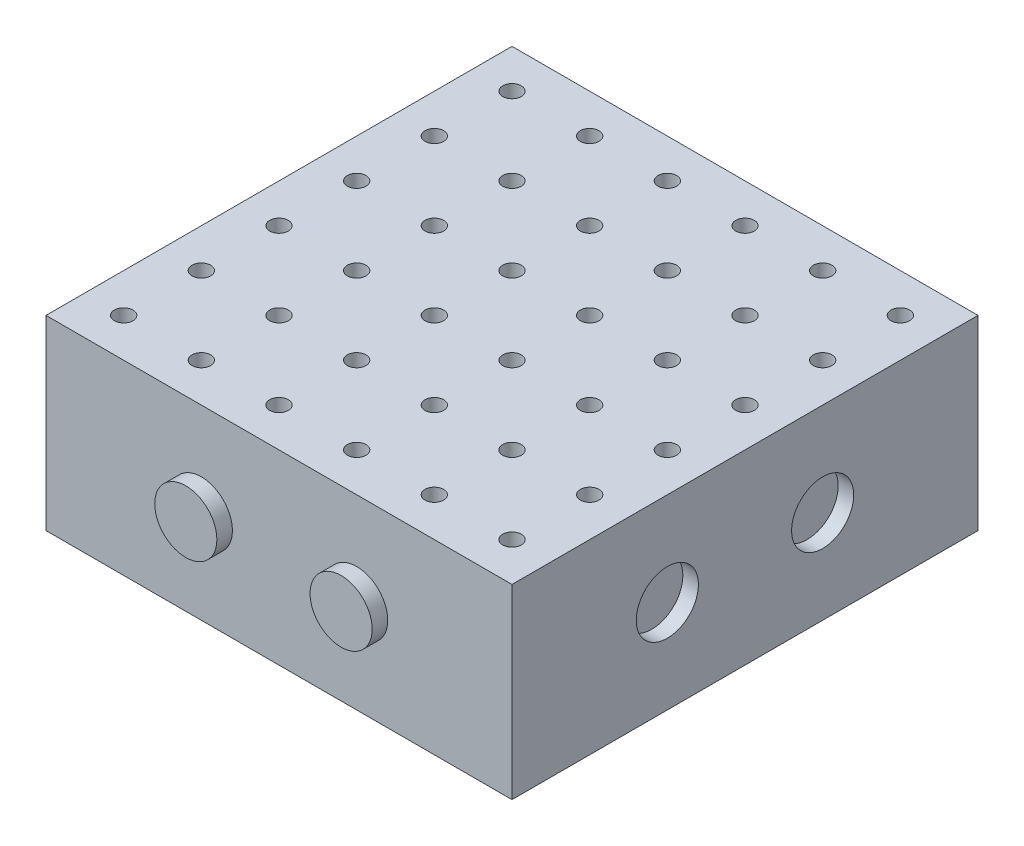
from build123d import *

# Parameters (mm, degrees)
SKETCH1_W           = 150
SKETCH1_H           = 150
SKETCH1_R           = 3
BOSS_EXTRUDE1_DEPTH = 60
SKETCH4_R           = 10
BOSS_EXTRUDE3_DEPTH = 8
SKETCH4_6_R         = 10
CUT_EXTRUDE1_DEPTH  = 5
SKETCH5_R           = 10
CUT_EXTRUDE2_DEPTH  = 5
SKETCH6_R           = 10
BOSS_EXTRUDE4_DEPTH = 5
SKETCH7_R           = 10
BOSS_EXTRUDE5_DEPTH = 5
CUT_EXTRUDE3_DEPTH  = 15


with BuildPart() as part:
    # Sketch1 → Boss-Extrude1 (new body)
    with BuildSketch(Plane(origin=(0, 0, 0), x_dir=(1, 0, 0), z_dir=(0, 1, 0))):
        with Locations((19.022617124, 32.835218094)):
            Rectangle(SKETCH1_W, SKETCH1_H)
        with Locations((-43.477382875, 95.335218094)):
            Circle(SKETCH1_R, mode=Mode.SUBTRACT)
        with Locations((-18.477382875, 95.335218094)):
            Circle(SKETCH1_R, mode=Mode.SUBTRACT)
        with Locations((6.522617125, 95.335218094)):
            Circle(SKETCH1_R, mode=Mode.SUBTRACT)
        with Locations((31.522617125, 95.335218094)):
            Circle(SKETCH1_R, mode=Mode.SUBTRACT)
        with Locations((56.522617125, 95.335218094)):
            Circle(SKETCH1_R, mode=Mode.SUBTRACT)
        with Locations((81.522617125, 95.335218094)):
            Circle(SKETCH1_R, mode=Mode.SUBTRACT)
        with Locations((-18.477382875, 70.335218094)):
            Circle(SKETCH1_R, mode=Mode.SUBTRACT)
        with Locations((6.522617125, 70.335218094)):
            Circle(SKETCH1_R, mode=Mode.SUBTRACT)
        with Locations((31.522617125, 70.335218094)):
            Circle(SKETCH1_R, mode=Mode.SUBTRACT)
        with Locations((56.522617125, 70.335218094)):
            Circle(SKETCH1_R, mode=Mode.SUBTRACT)
        with Locations((81.522617125, 70.335218094)):
            Circle(SKETCH1_R, mode=Mode.SUBTRACT)
        with Locations((-18.477382875, 45.335218094)):
            Circle(SKETCH1_R, mode=Mode.SUBTRACT)
        with Locations((6.522617125, 45.335218094)):
            Circle(SKETCH1_R, mode=Mode.SUBTRACT)
        with Locations((31.522617125, 45.335218094)):
            Circle(SKETCH1_R, mode=Mode.SUBTRACT)
        with Locations((56.522617125, 45.335218094)):
            Circle(SKETCH1_R, mode=Mode.SUBTRACT)
        with Locations((81.522617125, 45.335218094)):
            Circle(SKETCH1_R, mode=Mode.SUBTRACT)
        with Locations((-18.477382875, 20.335218094)):
            Circle(SKETCH1_R, mode=Mode.SUBTRACT)
        with Locations((6.522617125, 20.335218094)):
            Circle(SKETCH1_R, mode=Mode.SUBTRACT)
        with Locations((31.522617125, 20.335218094)):
            Circle(SKETCH1_R, mode=Mode.SUBTRACT)
        with Locations((56.522617125, 20.335218094)):
            Circle(SKETCH1_R, mode=Mode.SUBTRACT)
        with Locations((81.522617125, 20.335218094)):
            Circle(SKETCH1_R, mode=Mode.SUBTRACT)
        with Locations((-18.477382875, -4.664781906)):
            Circle(SKETCH1_R, mode=Mode.SUBTRACT)
        with Locations((6.522617125, -4.664781906)):
            Circle(SKETCH1_R, mode=Mode.SUBTRACT)
        with Locations((31.522617125, -4.664781906)):
            Circle(SKETCH1_R, mode=Mode.SUBTRACT)
        with Locations((56.522617125, -4.664781906)):
            Circle(SKETCH1_R, mode=Mode.SUBTRACT)
        with Locations((81.522617125, -4.664781906)):
            Circle(SKETCH1_R, mode=Mode.SUBTRACT)
        with Locations((-18.477382875, -29.664781906)):
            Circle(SKETCH1_R, mode=Mode.SUBTRACT)
        with Locations((6.522617125, -29.664781906)):
            Circle(SKETCH1_R, mode=Mode.SUBTRACT)
        with Locations((31.522617125, -29.664781906)):
            Circle(SKETCH1_R, mode=Mode.SUBTRACT)
        with Locations((56.522617125, -29.664781906)):
            Circle(SKETCH1_R, mode=Mode.SUBTRACT)
        with Locations((81.522617125, -29.664781906)):
            Circle(SKETCH1_R, mode=Mode.SUBTRACT)
        with Locations((-43.477382875, 70.335218094)):
            Circle(SKETCH1_R, mode=Mode.SUBTRACT)
        with Locations((-43.477382875, 45.335218094)):
            Circle(SKETCH1_R, mode=Mode.SUBTRACT)
        with Locations((-43.477382875, 20.335218094)):
            Circle(SKETCH1_R, mode=Mode.SUBTRACT)
        with Locations((-43.477382875, -4.664781906)):
            Circle(SKETCH1_R, mode=Mode.SUBTRACT)
        with Locations((-43.477382875, -29.664781906)):
            Circle(SKETCH1_R, mode=Mode.SUBTRACT)
    extrude(amount=BOSS_EXTRUDE1_DEPTH)

    # Sketch4 → Boss-Extrude3 (add)
    with BuildSketch(Plane(origin=(94.022617124, 0, 0), x_dir=(0, 0, -1), z_dir=(1, 0, 0))):
        with Locations((57.835218094, 30)):
            Circle(SKETCH4_R)
    extrude(amount=-BOSS_EXTRUDE3_DEPTH)

    # Sketch4<6> → Cut-Extrude1 (cut)
    with BuildSketch(Plane(origin=(94.022617124, 0, 0), x_dir=(0, 0, -1), z_dir=(1, 0, 0))):
        with Locations((7.835218094, 30)):
            Circle(SKETCH4_6_R)
        with Locations((57.835218094, 30)):
            Circle(SKETCH4_6_R)
    extrude(amount=-CUT_EXTRUDE1_DEPTH, mode=Mode.SUBTRACT)

    # Sketch5 → Cut-Extrude2 (cut)
    with BuildSketch(Plane(origin=(0, 0, -107.835218094), x_dir=(-1, 0, 0), z_dir=(0, 0, -1))):
        with Locations((-44.022617124, 30)):
            Circle(SKETCH5_R)
        with Locations((5.977382876, 30)):
            Circle(SKETCH5_R)
    extrude(amount=-CUT_EXTRUDE2_DEPTH, mode=Mode.SUBTRACT)

    # Sketch6 → Boss-Extrude4 (add)
    with BuildSketch(Plane.ZY.offset(55.977382876)):
        with Locations((-57.835218094, 30)):
            Circle(SKETCH6_R)
        with Locations((-7.835218094, 30)):
            Circle(SKETCH6_R)
    extrude(amount=BOSS_EXTRUDE4_DEPTH)

    # Sketch7 → Boss-Extrude5 (add)
    with BuildSketch(Plane.XY.offset(42.164781906)):
        with Locations((-5.977382876, 30)):
            Circle(SKETCH7_R)
        with Locations((44.022617124, 30)):
            Circle(SKETCH7_R)
    extrude(amount=BOSS_EXTRUDE5_DEPTH)

    # Sketch8 → Cut-Extrude3 (cut)
    with BuildSketch(Plane.XZ):
        with BuildLine():
            Line((-41.977382876, 38.164781906), (80.022617124, 38.164781906))
            ThreePointArc((80.022617124, 38.164781906), (87.093684936, 35.235849718), (90.022617124, 28.164781906))
            Line((90.022617124, 28.164781906), (90.022617124, -93.835218094))
            ThreePointArc((90.022617124, -93.835218094), (87.093684936, -100.906285906), (80.022617124, -103.835218094))
            Line((80.022617124, -103.835218094), (-41.977382876, -103.835218094))
            ThreePointArc((-41.977382876, -103.835218094), (-49.048450687, -100.906285906), (-51.977382876, -93.835218094))
            Line((-51.977382876, -93.835218094), (-51.977382876, 28.164781906))
            ThreePointArc((-51.977382876, 28.164781906), (-49.048450687, 35.235849718), (-41.977382876, 38.164781906))
        make_face()
    extrude(amount=-CUT_EXTRUDE3_DEPTH, mode=Mode.SUBTRACT)


solid = part.part
